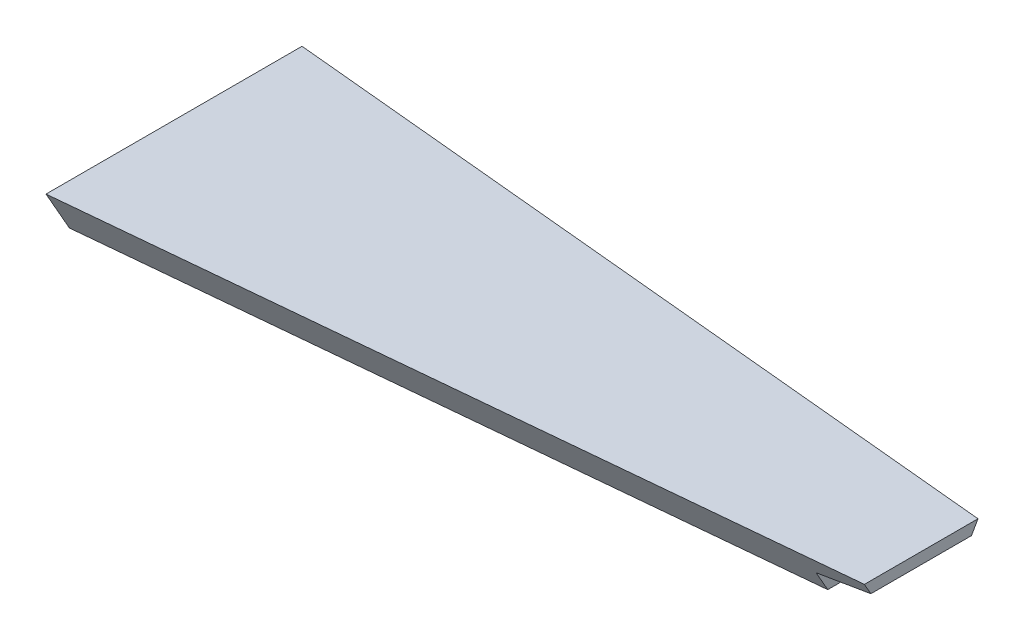
from build123d import *

# Parameters (mm, degrees)
BOSS_EXTRUDE1_DEPTH     = 19.05
BOSS_EXTRUDE1_DRAFT     = -29.54735891
CUT_EXTRUDE1_DEPTH      = 374.741958864
CUT_EXTRUDE1_DEPTH_BACK = 374.741958864
SKETCH2_OUTSIDE_W       = 447.362
SKETCH2_OUTSIDE_H       = 98.57
SKETCH2_OUTSIDE_W_2     = 346.244171738
SKETCH2_OUTSIDE_H_2     = 100.341978652
CUT_EXTRUDE2_DEPTH      = 364.132941986


with BuildPart() as part:
    # Sketch1 → Boss-Extrude1 (with draft: the straight prism first)
    with BuildSketch(Plane(origin=(0, 0, 0), x_dir=(1, 0, 0), z_dir=(0, 1, 0))):
        Polygon((0, 0), (0, -96.93730792), (346.244171738, -63.94360396), (346.244171738, -32.99370396), align=None)
    extrude(amount=BOSS_EXTRUDE1_DEPTH)
    # Boss-Extrude1: the draft: its side faces are tilted about the plane it starts from
    boss_extrude1_sides = [part.faces().sort_by_distance(p)[0] for p in [
        (0, 9.525, 48.46865396),
        (173.122085869, 9.525, 80.44045594),
        (346.244171738, 9.525, 48.46865396),
        (173.122085869, 9.525, 16.49685198),
    ]]
    draft(boss_extrude1_sides, Plane(origin=(0, 0, 0), x_dir=(1, 0, 0), z_dir=(0, 1, 0)), BOSS_EXTRUDE1_DRAFT)

    # Sketch2 outside → Cut-Extrude1 (cut, two sides: drawn at the far end of the back side and taken through both)
    with BuildSketch(Plane.XY.offset(-CUT_EXTRUDE1_DEPTH_BACK)):
        with Locations((173.122, 9.525)):
            Rectangle(SKETCH2_OUTSIDE_W, SKETCH2_OUTSIDE_H)
        with Locations((173.122085869, 50.170989326)):
            Rectangle(SKETCH2_OUTSIDE_W_2, SKETCH2_OUTSIDE_H_2, mode=Mode.SUBTRACT)
    extrude(amount=CUT_EXTRUDE1_DEPTH + CUT_EXTRUDE1_DEPTH_BACK, mode=Mode.SUBTRACT)

    # Sketch3 → Cut-Extrude2 (cut, through all)
    with BuildSketch(Plane.XY):
        Polygon((320.844171738, 0), (320.844171738, 9.525), (346.244171738, 13.775502271), (346.244171738, 0), align=None)
    extrude(amount=CUT_EXTRUDE2_DEPTH, mode=Mode.SUBTRACT)


solid = part.part
